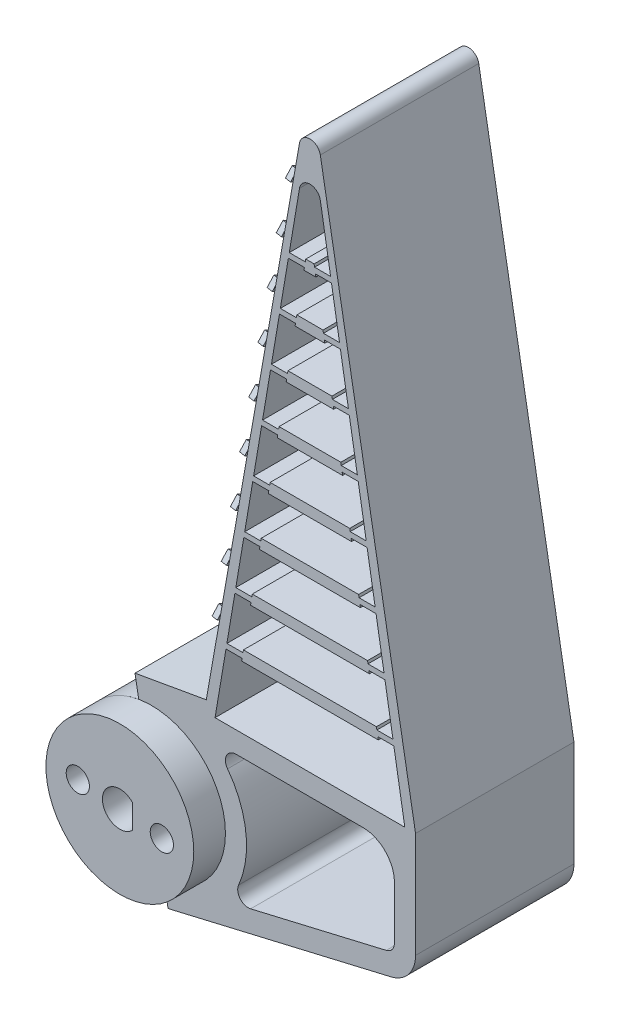
from build123d import *

# Parameters (mm, degrees)
SKETCH_10_W             = 20
SKETCH_10_H             = 10
EXTRUDE_5_DEPTH         = 7.5
EXTRUDE_6_DEPTH         = 15
SKETCH_12_R             = 9
EXTRUDE_7_DEPTH         = 7.5
CUT_EXTRUDE_5_DEPTH     = 2.625
HOLE_WIZARD_2_2_2_2_1_D = 2.2
SKETCH_18_R             = 1.5
CUT_EXTRUDE_6_DEPTH     = 17.625
EXTRUDE_START           = -15
EXTRUDE_8_DEPTH         = 4.875
EXTRUDE_9_DEPTH         = 15
CUT_EXTRUDE_START       = -35.25
CUT_EXTRUDE_7_DEPTH     = 35.25
FILLET_6_R              = 1
EXTRUDE_2_DEPTH         = 0.5
SKETCH_22_R             = 7
SKETCH_22_R_2           = 1.1
EXTRUDE_10_DEPTH        = 3
EXTRUDE_11_DEPTH        = 15


with BuildPart() as part:
    # 草图10 → 凸台-拉伸5 (new, symmetric)
    with BuildSketch(Plane.XY):
        with Locations((10, 5)):
            Rectangle(SKETCH_10_W, SKETCH_10_H)
        Polygon((10, 66.712818196), (0, 10), (1.015426612, 10), (10, 63.257650674), (18.984573388, 10), (20, 10), align=None)
    extrude(amount=EXTRUDE_5_DEPTH, both=True)

    # 草图11 → 凸台-拉伸6 (add)
    with BuildSketch(Plane.XY.offset(7.5)):
        Polygon((9.563370097, 51.652296308), (8.042175036, 51.652296308), (7.957824964, 51.152296308), (9.479020024, 51.152296308), (9.436844988, 50.902296308), (10.563155012, 50.902296308), (10.520979976, 51.152296308), (12.042175036, 51.152296308), (11.957824964, 51.652296308), (10.436629903, 51.652296308), (10.394454867, 51.902296308), (9.605545133, 51.902296308), align=None)
        Polygon((8.719869372, 46.652296308), (7.198674312, 46.652296308), (7.114324239, 46.152296308), (8.6355193, 46.152296308), (8.593344263, 45.902296308), (11.406655737, 45.902296308), (11.3644807, 46.152296308), (12.885675761, 46.152296308), (12.801325688, 46.652296308), (11.280130628, 46.652296308), (11.237955592, 46.902296308), (8.762044408, 46.902296308), align=None)
        Polygon((7.876368647, 41.652296308), (6.355173587, 41.652296308), (6.270823514, 41.152296308), (7.792018575, 41.152296308), (7.749843539, 40.902296308), (12.250156461, 40.902296308), (12.207981425, 41.152296308), (13.729176486, 41.152296308), (13.644826413, 41.652296308), (12.123631353, 41.652296308), (12.081456316, 41.902296308), (7.918543684, 41.902296308), align=None)
        Polygon((7.032867923, 36.652296308), (5.511672862, 36.652296308), (5.42732279, 36.152296308), (6.94851785, 36.152296308), (6.906342814, 35.902296308), (13.093657186, 35.902296308), (13.05148215, 36.152296308), (14.57267721, 36.152296308), (14.488327138, 36.652296308), (12.967132077, 36.652296308), (12.924957041, 36.902296308), (7.075042959, 36.902296308), align=None)
        Polygon((6.189367198, 31.652296308), (4.668172137, 31.652296308), (4.583822065, 31.152296308), (6.105017126, 31.152296308), (6.062842089, 30.902296308), (13.937157911, 30.902296308), (13.894982874, 31.152296308), (15.416177935, 31.152296308), (15.331827863, 31.652296308), (13.810632802, 31.652296308), (13.768457766, 31.902296308), (6.231542234, 31.902296308), align=None)
        Polygon((5.345866473, 26.652296308), (3.824671413, 26.652296308), (3.74032134, 26.152296308), (5.261516401, 26.152296308), (5.219341365, 25.902296308), (14.780658635, 25.902296308), (14.738483599, 26.152296308), (16.25967866, 26.152296308), (16.175328587, 26.652296308), (14.654133527, 26.652296308), (14.61195849, 26.902296308), (5.38804151, 26.902296308), align=None)
        Polygon((4.502365749, 21.652296308), (2.981170688, 21.652296308), (2.896820615, 21.152296308), (4.418015676, 21.152296308), (4.37584064, 20.902296308), (15.62415936, 20.902296308), (15.581984324, 21.152296308), (17.103179385, 21.152296308), (17.018829312, 21.652296308), (15.497634251, 21.652296308), (15.455459215, 21.902296308), (4.544540785, 21.902296308), align=None)
        Polygon((3.658865024, 16.652296308), (2.137669963, 16.652296308), (2.053319891, 16.152296308), (3.574514951, 16.152296308), (3.532339915, 15.902296308), (16.467660085, 15.902296308), (16.425485049, 16.152296308), (17.946680109, 16.152296308), (17.862330037, 16.652296308), (16.341134976, 16.652296308), (16.29895994, 16.902296308), (3.70104006, 16.902296308), align=None)
    extrude(amount=-EXTRUDE_6_DEPTH)

    # 草图12 → 凸台-拉伸7 (add, symmetric)
    with BuildSketch(Plane(origin=(0, 0, 0), x_dir=(-1, 0, 0), z_dir=(0, 0, -1))):
        with Locations((5, 1)):
            Circle(SKETCH_12_R)
    extrude(amount=EXTRUDE_7_DEPTH, both=True)

    # 草图12<3> → 切除-拉伸5 (cut, symmetric)
    with BuildSketch(Plane(origin=(0, 0, 0), x_dir=(-1, 0, 0), z_dir=(0, 0, -1))):
        with BuildLine():
            Line((6.562833599, 9.863269777), (6.432597466, 9.124663962))
            ThreePointArc((6.432597466, 9.124663962), (-3.124663962, 2.432597466), (3.567402534, -7.124663962))
            Line((3.567402534, -7.124663962), (3.437166401, -7.863269777))
            ThreePointArc((3.437166401, -7.863269777), (13.863269777, -0.562833599), (6.562833599, 9.863269777))
        make_face()
    extrude(amount=CUT_EXTRUDE_5_DEPTH, both=True, mode=Mode.SUBTRACT)

    # Ø2.2 (2.2) 直径孔1 (through all)
    with Locations(Plane(origin=(0, 0, -7.5), x_dir=(-1, 0, 0), z_dir=(0, 0, -1))):
        with Locations((1.021912419, 0.581886147), (8.978087581, 1.418113853)):
            Hole(HOLE_WIZARD_2_2_2_2_1_D / 2)

    # 草图18 → 切除-拉伸6 (cut, symmetric)
    with BuildSketch(Plane.XY.offset(7.5)):
        with BuildLine():
            Line((-6.215537244, 7.893654271), (-6.562833599, 9.863269777))
            ThreePointArc((-6.562833599, 9.863269777), (-13.863269777, -0.562833599), (-3.437166401, -7.863269777))
            Line((-3.437166401, -7.863269777), (-3.784462756, -5.893654271))
            ThreePointArc((-3.784462756, -5.893654271), (-11.893654271, -0.215537244), (-6.215537244, 7.893654271))
        make_face()
        with Locations((-5, 1)):
            Circle(SKETCH_18_R)
    extrude(amount=CUT_EXTRUDE_6_DEPTH, both=True, mode=Mode.SUBTRACT)

    # 草图17 → 凸台-拉伸8 (add)
    with BuildSketch(Plane(origin=(0, 0, -7.5), x_dir=(-1, 0, 0), z_dir=(0, 0, -1)).offset(EXTRUDE_START)):
        with BuildLine():
            Line((3.95, 2.071214264), (3.95, -0.071214264))
            ThreePointArc((3.95, -0.071214264), (3.5, 1), (3.95, 2.071214264))
        make_face()
    extrude(amount=EXTRUDE_8_DEPTH)

    # 草图19 → 凸台-拉伸9 (add)
    with BuildSketch(Plane.XY.offset(7.5).offset(EXTRUDE_START)):
        with BuildLine():
            Line((3.94427191, 0), (20, 0))
            ThreePointArc((20, 0), (19.351199172, -1.863293443), (17.68542503, -2.920649333))
            Line((17.68542503, -2.920649333), (-2.943724909, -7.761948))
            ThreePointArc((-2.943724909, -7.761948), (1.731639308, -4.973695023), (3.94427191, 0))
        make_face()
    extrude(amount=EXTRUDE_9_DEPTH)

    # 草图20 → 切除-拉伸7 (cut)
    with BuildSketch(Plane.XY.offset(7.5).offset(CUT_EXTRUDE_START)):
        with BuildLine():
            Line((15, 8), (3, 8))
            ThreePointArc((3, 8), (2.105572809, 7.447213595), (2.2, 6.4))
            ThreePointArc((2.2, 6.4), (3.940288921, 2.035004348), (3.243323454, -2.612148727))
            ThreePointArc((3.243323454, -2.612148727), (3.39065602, -3.653237544), (4.387723293, -3.987048363))
            Line((4.387723293, -3.987048363), (17.22847501, -0.973549778))
            ThreePointArc((17.22847501, -0.973549778), (17.783733057, -0.621097814), (18, 0))
            Line((18, 0), (18, 5))
            ThreePointArc((18, 5), (17.121320344, 7.121320344), (15, 8))
        make_face()
    extrude(amount=CUT_EXTRUDE_7_DEPTH, mode=Mode.SUBTRACT)

    # 圆角6
    fillet_6_edges = [part.edges().sort_by_distance(p)[0] for p in [
        (10, 66.712818196, 0),
        (10, 63.257650674, 0),
    ]]
    fillet(fillet_6_edges, radius=FILLET_6_R)

    # 草图21 → 拉伸-薄壁2 (add)
    with BuildSketch(Plane(origin=(-1.710100717, 0.301536896, 0), x_dir=(0, 0, 1), z_dir=(-0.9848077530122074, 0.17364817766693436, 0))):
        Polygon((-7.75, 58.33148784), (0, 53.857023254), (7.75, 58.33148784), (7.25, 59.197513244), (0, 55.011723792), (-7.25, 59.197513244), align=None)
        Polygon((-7.75, 53.33148784), (0, 48.857023254), (7.75, 53.33148784), (7.25, 54.197513244), (0, 50.011723792), (-7.25, 54.197513244), align=None)
        Polygon((-7.75, 48.33148784), (0, 43.857023254), (7.75, 48.33148784), (7.25, 49.197513244), (0, 45.011723792), (-7.25, 49.197513244), align=None)
        Polygon((-7.75, 43.33148784), (0, 38.857023254), (7.75, 43.33148784), (7.25, 44.197513244), (0, 40.011723792), (-7.25, 44.197513244), align=None)
        Polygon((-7.75, 38.33148784), (0, 33.857023254), (7.75, 38.33148784), (7.25, 39.197513244), (0, 35.011723792), (-7.25, 39.197513244), align=None)
        Polygon((-7.75, 33.33148784), (0, 28.857023254), (7.75, 33.33148784), (7.25, 34.197513244), (0, 30.011723792), (-7.25, 34.197513244), align=None)
        Polygon((-7.75, 28.33148784), (0, 23.857023254), (7.75, 28.33148784), (7.25, 29.197513244), (0, 25.011723792), (-7.25, 29.197513244), align=None)
        Polygon((-7.75, 23.33148784), (0, 18.857023254), (7.75, 23.33148784), (7.25, 24.197513244), (0, 20.011723792), (-7.25, 24.197513244), align=None)
        Polygon((-7.75, 18.33148784), (0, 13.857023254), (7.75, 18.33148784), (7.25, 19.197513244), (0, 15.011723792), (-7.25, 19.197513244), align=None)
    extrude(amount=EXTRUDE_2_DEPTH)

    # 草图23 → 凸台-拉伸11 (add)
    with BuildSketch(Plane(origin=(0, 0, -7.5), x_dir=(-1, 0, 0), z_dir=(0, 0, -1))):
        with BuildLine():
            Line((6.562833599, 9.863269777), (-0.185711155, 11.053220298))
            Line((-0.185711155, 11.053220298), (0, 10))
            Line((0, 10), (0, 8.483314774))
            ThreePointArc((0, 8.483314774), (3.148082839, 9.807406135), (6.562833599, 9.863269777))
        make_face()
    extrude(amount=-EXTRUDE_11_DEPTH)


with BuildPart() as body_2:
    # 草图22 → 凸台-拉伸10 (new body)
    with BuildSketch(Plane.XY.offset(7.5)):
        with Locations((-5, 1)):
            Circle(SKETCH_22_R)
        with Locations((-1.021912419, 0.581886147)):
            Circle(SKETCH_22_R_2, mode=Mode.SUBTRACT)
        with Locations((-8.978087581, 1.418113853)):
            Circle(SKETCH_22_R_2, mode=Mode.SUBTRACT)
        with BuildLine():
            Line((-3.8, -0.132475165), (-3.8, 2.132475165))
            ThreePointArc((-3.8, 2.132475165), (-6.65, 1), (-3.8, -0.132475165))
        make_face(mode=Mode.SUBTRACT)
    extrude(amount=EXTRUDE_10_DEPTH)


solid = Compound([part.part, body_2.part])
